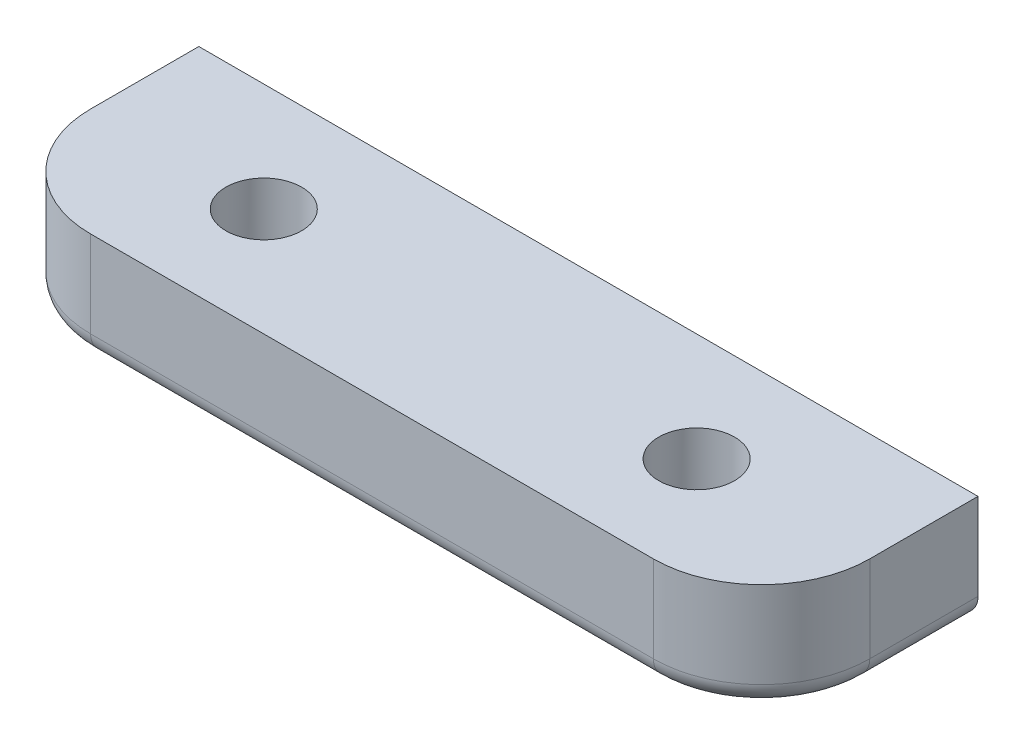
from build123d import *

# Parameters (mm, degrees)
SKETCH_1_W             = 36
SKETCH_1_H             = 5
EXTRUDE_376_DEPTH      = 5
SKETCH_4_R             = 1
I2C_DEPTH              = 9
SKETCH_5_R             = 1.75
CUT_EXTRUDE_974_DEPTH  = 20.339079606
SKETCH_6_R             = 3.2
CUT_EXTRUDE_1213_DEPTH = 2
FILLET_1_R             = 5
FILLET_2_R             = 1


with BuildPart() as part:
    # Эскиз1 → Extrude 376 (new, symmetric)
    with BuildSketch(Plane.XY):
        Rectangle(SKETCH_1_W, SKETCH_1_H)
    extrude(amount=EXTRUDE_376_DEPTH, both=True)

    # Эскиз4 → i2c (cut)
    with BuildSketch(Plane(origin=(0, 0, -5), x_dir=(-1, 0, 0), z_dir=(0, 0, -1))):
        with Locations((-14.75, -0.5)):
            Circle(SKETCH_4_R)
        with Locations((14.75, 0)):
            Circle(SKETCH_4_R)
    extrude(amount=-I2C_DEPTH, mode=Mode.SUBTRACT)

    # Эскиз5 → Cut-Extrude 974 (cut, through all)
    with BuildSketch(Plane(origin=(0, 2.5, 0), x_dir=(1, 0, 0), z_dir=(0, 1, 0))):
        with Locations(Location((-10, 0, 0), (0, 0, 270))):
            Circle(SKETCH_5_R)
        with Locations(Location((10, 0, 0), (0, 0, 270))):
            Circle(SKETCH_5_R)
    extrude(amount=-CUT_EXTRUDE_974_DEPTH, mode=Mode.SUBTRACT)

    # Эскиз6 → Cut-Extrude 1213 (cut)
    with BuildSketch(Plane(origin=(0, -2.5, 0), x_dir=(1, 0, 0), z_dir=(0, 1, 0))):
        with Locations(Location((-10, 0, 0), (0, 0, 90))):
            Circle(SKETCH_6_R)
        with Locations(Location((10, 0, 0), (0, 0, 90))):
            Circle(SKETCH_6_R)
    extrude(amount=CUT_EXTRUDE_1213_DEPTH, mode=Mode.SUBTRACT)

    # Скругление1
    fillet_1_edges = [part.edges().sort_by_distance(p)[0] for p in [
        (18, 0, 5),
        (-18, 0, 5),
    ]]
    fillet(fillet_1_edges, radius=FILLET_1_R)

    # Скругление2
    fillet_2_edges = [part.edges().sort_by_distance(p)[0] for p in [
        (0, -2.5, 5),
        (18, -2.5, -2.5),
        (-18, -2.5, -2.5),
        (16.535533906, -2.5, 3.535533906),
        (-16.535533906, -2.5, 3.535533906),
    ]]
    fillet(fillet_2_edges, radius=FILLET_2_R)


solid = part.part
